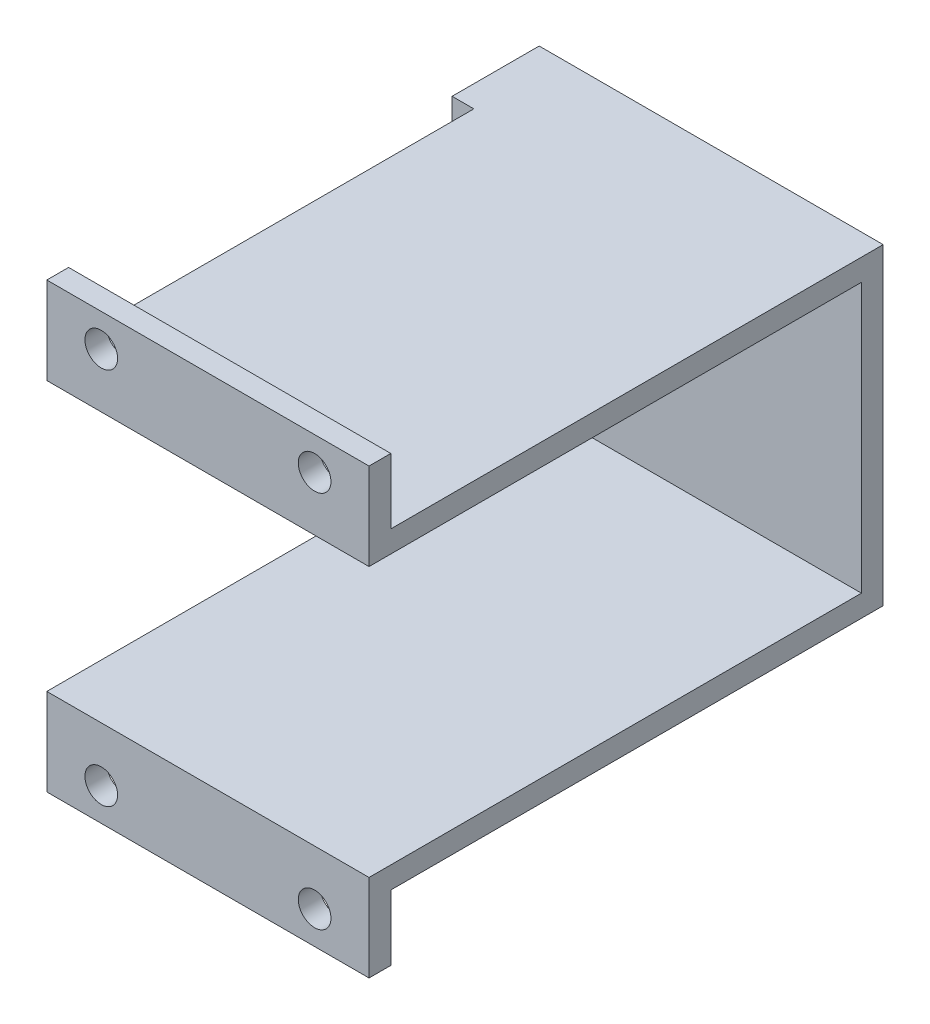
from build123d import *

# Parameters (mm, degrees)
SKETCH_1_W          = 29.6
SKETCH_1_H          = 28.73
EXTRUDE_1_DEPTH     = 47.23
SKETCH_2_W          = 29.6
SKETCH_2_H          = 24.73
CUT_EXTRUDE_1_DEPTH = 45.23
SKETCH_3_W          = 8
SKETCH_3_H          = 28.73
EXTRUDE_2_DEPTH     = 2
SKETCH_4_W          = 29.6
SKETCH_4_H          = 6
EXTRUDE_3_DEPTH     = 2
SKETCH_5_R          = 1.5
CUT_EXTRUDE_2_DEPTH = 53.37104281


with BuildPart() as part:
    # 草图1 → 凸台-拉伸1 (new body)
    with BuildSketch(Plane.XY):
        Rectangle(SKETCH_1_W, SKETCH_1_H)
    extrude(amount=EXTRUDE_1_DEPTH)

    # 草图2 → 切除-拉伸1 (cut)
    with BuildSketch(Plane.XY.offset(47.23)):
        Rectangle(SKETCH_2_W, SKETCH_2_H)
    extrude(amount=-CUT_EXTRUDE_1_DEPTH, mode=Mode.SUBTRACT)

    # 草图3 → 凸台-拉伸2 (add)
    with BuildSketch(Plane.ZY.offset(14.8)):
        with Locations((4, 0)):
            Rectangle(SKETCH_3_W, SKETCH_3_H)
    extrude(amount=EXTRUDE_2_DEPTH)

    # 草图4 → 凸台-拉伸3 (add)
    with BuildSketch(Plane.XY.offset(47.23)):
        with Locations((0, 17.365)):
            Rectangle(SKETCH_4_W, SKETCH_4_H)
    extrude_3 = extrude(amount=-EXTRUDE_3_DEPTH)

    # 草图5 → 切除-拉伸2 (cut, through all)
    with BuildSketch(Plane(origin=(0, 0, 45.23), x_dir=(-1, 0, 0), z_dir=(0, 0, -1))):
        with Locations((-9.8, 17.365)):
            Circle(SKETCH_5_R)
        with Locations((9.8, 17.365)):
            Circle(SKETCH_5_R)
    cut_extrude_2 = extrude(amount=-CUT_EXTRUDE_2_DEPTH, mode=Mode.SUBTRACT)

    # 镜向2: 凸台-拉伸3, 切除-拉伸2 across plane
    add(extrude_3.mirror(Plane.ZX))
    add(cut_extrude_2.mirror(Plane.ZX), mode=Mode.SUBTRACT)


solid = part.part
